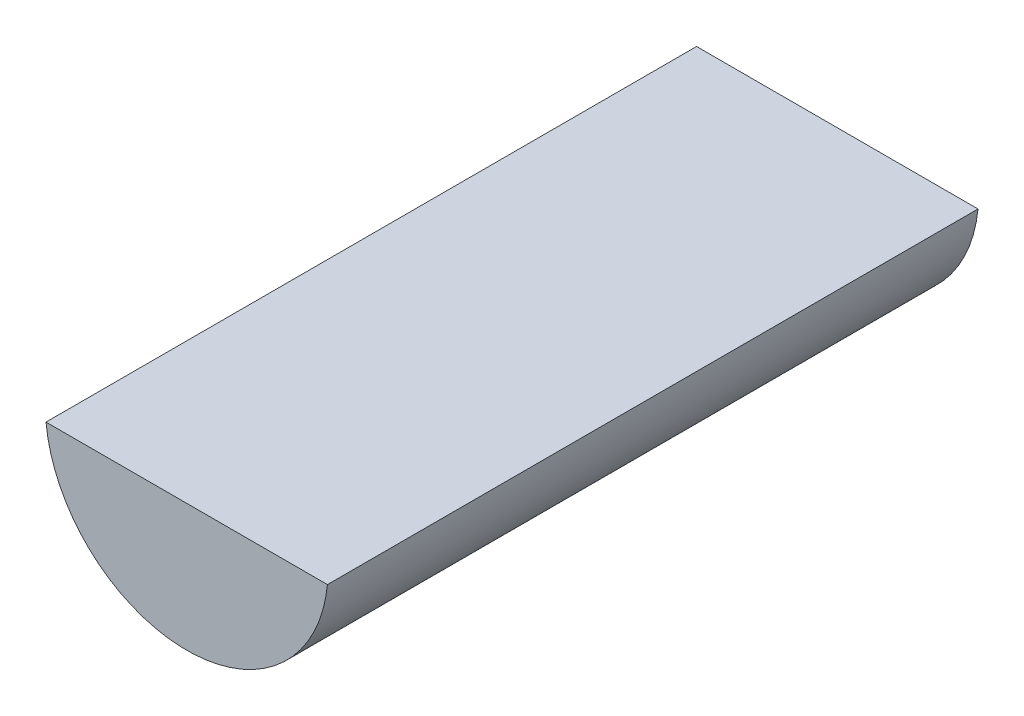
from build123d import *

# Parameters (mm, degrees)
BOSS_EXTRUDE1_DEPTH = 230


with BuildPart() as part:
    # Sketch1 → Boss-Extrude1 (new body)
    with BuildSketch(Plane.XY):
        with BuildLine():
            Line((-49.749371855, -5), (49.749371855, -5))
            ThreePointArc((49.749371855, -5), (0, -50), (-49.749371855, -5))
        make_face()
    extrude(amount=BOSS_EXTRUDE1_DEPTH)


solid = part.part
